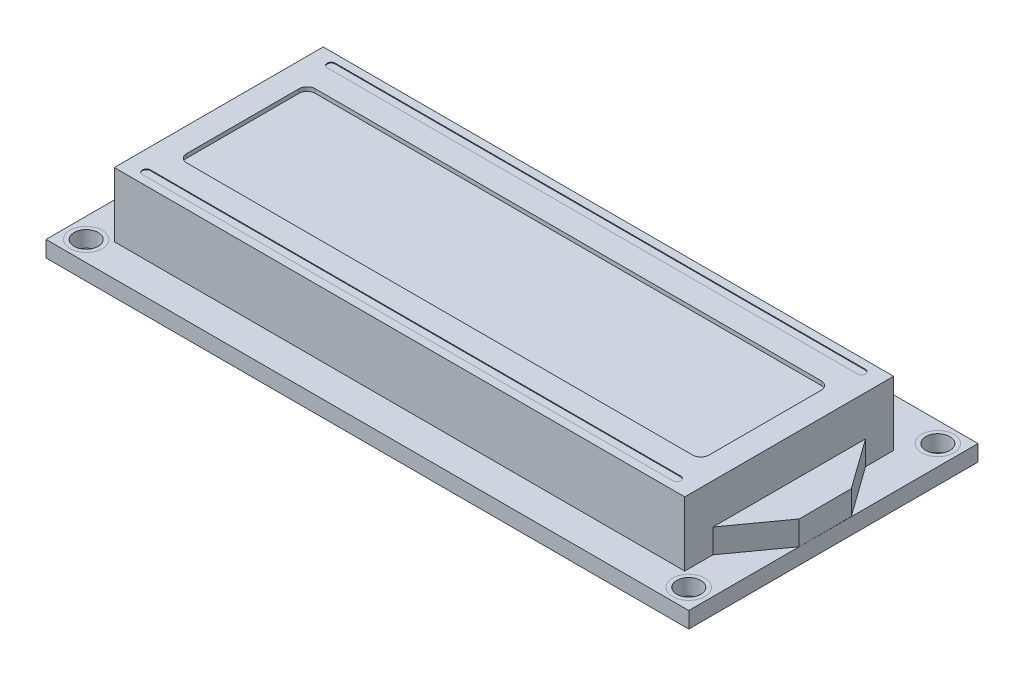
from build123d import *

# Parameters (mm, degrees)
SKETCH1_W           = 80
SKETCH1_H           = 36
BOSS_EXTRUDE1_DEPTH = 2
SKETCH2_R           = 1.5
CUT_EXTRUDE1_DEPTH  = 44.9089968
SKETCH3_W           = 71
SKETCH3_H           = 26
BOSS_EXTRUDE2_DEPTH = 8
CUT_EXTRUDE2_DEPTH  = 0.5
CUT_EXTRUDE3_DEPTH  = 0.1
BOSS_EXTRUDE3_DEPTH = 3
SKETCH10_R          = 0.5
CUT_EXTRUDE4_DEPTH  = 45.586993619


with BuildPart() as part:
    # Sketch1 → Boss-Extrude1 (new body)
    with BuildSketch(Plane(origin=(0, 0, 0), x_dir=(1, 0, 0), z_dir=(0, 1, 0))):
        Rectangle(SKETCH1_W, SKETCH1_H)
    extrude(amount=BOSS_EXTRUDE1_DEPTH)

    # Sketch2 → Cut-Extrude1 (cut, through all)
    with BuildSketch(Plane(origin=(0, 2, 0), x_dir=(1, 0, 0), z_dir=(0, 1, 0))):
        with Locations(Location((-37.5, 15.5, 0), (0, 0, 270))):
            Circle(SKETCH2_R)
        with Locations(Location((37.5, 15.5, 0), (0, 0, 90))):
            Circle(SKETCH2_R)
        with Locations(Location((-37.5, -15.5, 0), (0, 0, 90))):
            Circle(SKETCH2_R)
        with Locations(Location((37.5, -15.5, 0), (0, 0, 270))):
            Circle(SKETCH2_R)
    extrude(amount=-CUT_EXTRUDE1_DEPTH, mode=Mode.SUBTRACT)

    # Sketch3 → Boss-Extrude2 (add)
    with BuildSketch(Plane(origin=(0, 2, 0), x_dir=(1, 0, 0), z_dir=(0, 1, 0))):
        with Locations((0, -1)):
            Rectangle(SKETCH3_W, SKETCH3_H)
    extrude(amount=BOSS_EXTRUDE2_DEPTH)

    # Sketch5 → Cut-Extrude2 (cut)
    with BuildSketch(Plane(origin=(0, 10, 0), x_dir=(1, 0, 0), z_dir=(0, 1, 0))):
        with BuildLine():
            Line((-31.5, 7), (31.5, 7))
            ThreePointArc((31.5, 7), (32.207106781, 6.707106781), (32.5, 6))
            Line((32.5, 6), (32.5, -8))
            ThreePointArc((32.5, -8), (32.207106781, -8.707106781), (31.5, -9))
            Line((31.5, -9), (-31.5, -9))
            ThreePointArc((-31.5, -9), (-32.207106781, -8.707106781), (-32.5, -8))
            Line((-32.5, -8), (-32.5, 6))
            ThreePointArc((-32.5, 6), (-32.207106781, 6.707106781), (-31.5, 7))
        make_face()
    extrude(amount=-CUT_EXTRUDE2_DEPTH, mode=Mode.SUBTRACT)

    # Sketch6 → Cut-Extrude3 (cut)
    with BuildSketch(Plane(origin=(0, 10, 0), x_dir=(1, 0, 0), z_dir=(0, 1, 0))):
        with BuildLine():
            Line((33.01, 10), (-33.01, 10))
            ThreePointArc((-33.01, 10), (-33.356482323, 10.143517677), (-33.5, 10.49))
            Line((-33.5, 10.49), (-33.5, 10.51))
            ThreePointArc((-33.5, 10.51), (-33.356482323, 10.856482323), (-33.01, 11))
            Line((-33.01, 11), (33.01, 11))
            ThreePointArc((33.01, 11), (33.356482323, 10.856482323), (33.5, 10.51))
            Line((33.5, 10.51), (33.5, 10.49))
            ThreePointArc((33.5, 10.49), (33.356482323, 10.143517677), (33.01, 10))
        make_face()
        with BuildLine():
            Line((-33.5, -12.49), (-33.5, -12.51))
            ThreePointArc((-33.5, -12.51), (-33.356482323, -12.856482323), (-33.01, -13))
            Line((-33.01, -13), (33.01, -13))
            ThreePointArc((33.01, -13), (33.356482323, -12.856482323), (33.5, -12.51))
            Line((33.5, -12.51), (33.5, -12.49))
            ThreePointArc((33.5, -12.49), (33.356482323, -12.143517677), (33.01, -12))
            Line((33.01, -12), (-33.01, -12))
            ThreePointArc((-33.01, -12), (-33.356482323, -12.143517677), (-33.5, -12.49))
        make_face()
    extrude(amount=-CUT_EXTRUDE3_DEPTH, mode=Mode.SUBTRACT)

    # Sketch7 → Boss-Extrude3 (add)
    with BuildSketch(Plane(origin=(0, 2, 0), x_dir=(1, 0, 0), z_dir=(0, 1, 0))):
        Polygon((35.5, 8.5), (35.5, -10.5), (40, -4.249984615), (39.98, 2.249984615), align=None)
    extrude(amount=BOSS_EXTRUDE3_DEPTH)

    # Sketch10 → Cut-Extrude4 (cut, through all)
    with BuildSketch(Plane(origin=(0, 2, 0), x_dir=(1, 0, 0), z_dir=(0, 1, 0))):
        with Locations(Location((-32, 16, 0), (0, 0, 270))):
            Circle(SKETCH10_R)
        with Locations(Location((-29.5, 16, 0), (0, 0, 270))):
            Circle(SKETCH10_R)
        with Locations(Location((-27, 16, 0), (0, 0, 270))):
            Circle(SKETCH10_R)
        with Locations(Location((-24.5, 16, 0), (0, 0, 270))):
            Circle(SKETCH10_R)
        with Locations(Location((-22, 16, 0), (0, 0, 270))):
            Circle(SKETCH10_R)
        with Locations(Location((-19.5, 16, 0), (0, 0, 270))):
            Circle(SKETCH10_R)
        with Locations(Location((-17, 16, 0), (0, 0, 270))):
            Circle(SKETCH10_R)
        with Locations(Location((-14.5, 16, 0), (0, 0, 270))):
            Circle(SKETCH10_R)
        with Locations(Location((-12, 16, 0), (0, 0, 270))):
            Circle(SKETCH10_R)
        with Locations(Location((-9.5, 16, 0), (0, 0, 270))):
            Circle(SKETCH10_R)
        with Locations(Location((-7, 16, 0), (0, 0, 270))):
            Circle(SKETCH10_R)
        with Locations(Location((-4.5, 16, 0), (0, 0, 270))):
            Circle(SKETCH10_R)
        with Locations(Location((-2, 16, 0), (0, 0, 270))):
            Circle(SKETCH10_R)
        with Locations(Location((0.5, 16, 0), (0, 0, 270))):
            Circle(SKETCH10_R)
        with Locations(Location((3, 16, 0), (0, 0, 270))):
            Circle(SKETCH10_R)
        with Locations(Location((5.5, 16, 0), (0, 0, 270))):
            Circle(SKETCH10_R)
    extrude(amount=-CUT_EXTRUDE4_DEPTH, mode=Mode.SUBTRACT)


solid = part.part
